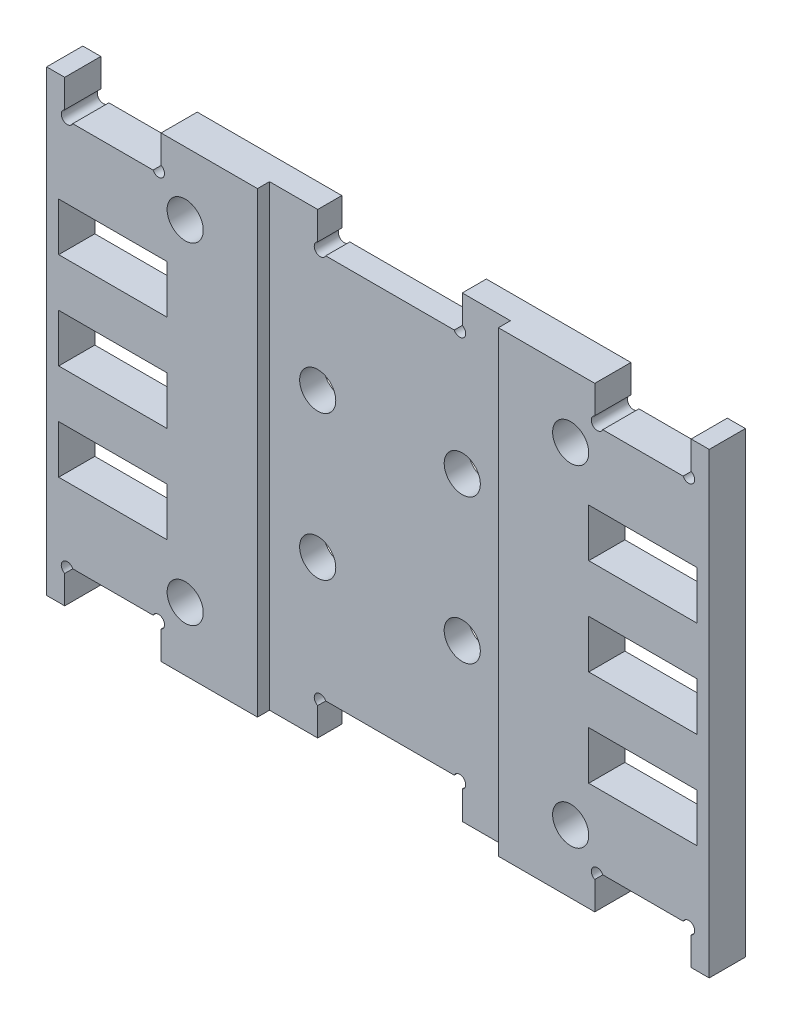
from build123d import *

# Parameters (mm, degrees)
SKETCH_1_W          = 55
SKETCH_1_H          = 38
EXTRUDE_1_DEPTH     = 3
SKETCH_2_R          = 1.5
CUT_EXTRUDE_1_DEPTH = 30
SKETCH_3_W          = 8
SKETCH_3_H          = 3
CUT_EXTRUDE_2_DEPTH = 30
SKETCH_4_W          = 20
SKETCH_4_H          = 38
CUT_EXTRUDE_3_DEPTH = 1
SKETCH_5_W          = 9
SKETCH_5_H          = 4
CUT_EXTRUDE_4_DEPTH = 10
SKETCH_6_W          = 12
SKETCH_6_H          = 3
CUT_EXTRUDE_5_DEPTH = 10
SKETCH_8_R          = 1.5
CUT_EXTRUDE_6_DEPTH = 10
SKETCH_9_R          = 0.5
CUT_EXTRUDE_7_DEPTH = 34.559648389


with BuildPart() as part:
    # 草图1 → 凸台-拉伸1 (new body)
    with BuildSketch(Plane.XY):
        Rectangle(SKETCH_1_W, SKETCH_1_H)
    extrude(amount=EXTRUDE_1_DEPTH)

    # 草图2 → 切除-拉伸1 (cut)
    with BuildSketch(Plane.XY.offset(3)):
        with Locations((16, 13.75)):
            Circle(SKETCH_2_R)
        with Locations((16, -13.75)):
            Circle(SKETCH_2_R)
        with Locations((-16, 13.75)):
            Circle(SKETCH_2_R)
        with Locations((-16, -13.75)):
            Circle(SKETCH_2_R)
    extrude(amount=-CUT_EXTRUDE_1_DEPTH, mode=Mode.SUBTRACT)

    # 草图3 → 切除-拉伸2 (cut)
    with BuildSketch(Plane.XY.offset(3)):
        with Locations((22, 17.5)):
            Rectangle(SKETCH_3_W, SKETCH_3_H)
        with Locations((22, -17.5)):
            Rectangle(SKETCH_3_W, SKETCH_3_H)
        with Locations((-22, 17.5)):
            Rectangle(SKETCH_3_W, SKETCH_3_H)
        with Locations((-22, -17.5)):
            Rectangle(SKETCH_3_W, SKETCH_3_H)
    extrude(amount=-CUT_EXTRUDE_2_DEPTH, mode=Mode.SUBTRACT)

    # 草图4 → 切除-拉伸3 (cut)
    with BuildSketch(Plane.XY.offset(3)):
        Rectangle(SKETCH_4_W, SKETCH_4_H)
    extrude(amount=-CUT_EXTRUDE_3_DEPTH, mode=Mode.SUBTRACT)

    # 草图5 → 切除-拉伸4 (cut)
    with BuildSketch(Plane.XY.offset(3)):
        with Locations((22, 8)):
            Rectangle(SKETCH_5_W, SKETCH_5_H)
        with Locations((22, 0)):
            Rectangle(SKETCH_5_W, SKETCH_5_H)
        with Locations((22, -8)):
            Rectangle(SKETCH_5_W, SKETCH_5_H)
        with Locations((-22, -8)):
            Rectangle(SKETCH_5_W, SKETCH_5_H)
        with Locations((-22, 8)):
            Rectangle(SKETCH_5_W, SKETCH_5_H)
        with Locations((-22, 0)):
            Rectangle(SKETCH_5_W, SKETCH_5_H)
    extrude(amount=-CUT_EXTRUDE_4_DEPTH, mode=Mode.SUBTRACT)

    # 草图6 → 切除-拉伸5 (cut)
    with BuildSketch(Plane.XY.offset(2)):
        with Locations((0, 17.5)):
            Rectangle(SKETCH_6_W, SKETCH_6_H)
        with Locations((0, -17.5)):
            Rectangle(SKETCH_6_W, SKETCH_6_H)
    extrude(amount=-CUT_EXTRUDE_5_DEPTH, mode=Mode.SUBTRACT)

    # 草图8 → 切除-拉伸6 (cut)
    with BuildSketch(Plane.XY.offset(2)):
        with Locations((6, -6)):
            Circle(SKETCH_8_R)
        with Locations((6, 6)):
            Circle(SKETCH_8_R)
        with Locations((-6, 6)):
            Circle(SKETCH_8_R)
        with Locations((-6, -6)):
            Circle(SKETCH_8_R)
    extrude(amount=-CUT_EXTRUDE_6_DEPTH, mode=Mode.SUBTRACT)

    # 草图9 → 切除-拉伸7 (cut, through all)
    with BuildSketch(Plane.XY.offset(3)):
        with Locations((25.787867966, -16.212132034)):
            Circle(SKETCH_9_R)
        with Locations((18.212132034, -16.212132034)):
            Circle(SKETCH_9_R)
        with Locations((18.212132034, 16.212132034)):
            Circle(SKETCH_9_R)
        with Locations((25.787867966, 16.212132034)):
            Circle(SKETCH_9_R)
        with Locations((-25.787867966, 16.212132034)):
            Circle(SKETCH_9_R)
        with Locations((-18.212132034, 16.212132034)):
            Circle(SKETCH_9_R)
        with Locations((-18.212132034, -16.212132034)):
            Circle(SKETCH_9_R)
        with Locations((-25.787867966, -16.212132034)):
            Circle(SKETCH_9_R)
        with Locations((5.787867966, -16.212132034)):
            Circle(SKETCH_9_R)
        with Locations((-5.787867966, -16.212132034)):
            Circle(SKETCH_9_R)
        with Locations((-5.787867966, 16.212132034)):
            Circle(SKETCH_9_R)
        with Locations((5.787867966, 16.212132034)):
            Circle(SKETCH_9_R)
    extrude(amount=-CUT_EXTRUDE_7_DEPTH, mode=Mode.SUBTRACT)


solid = part.part
